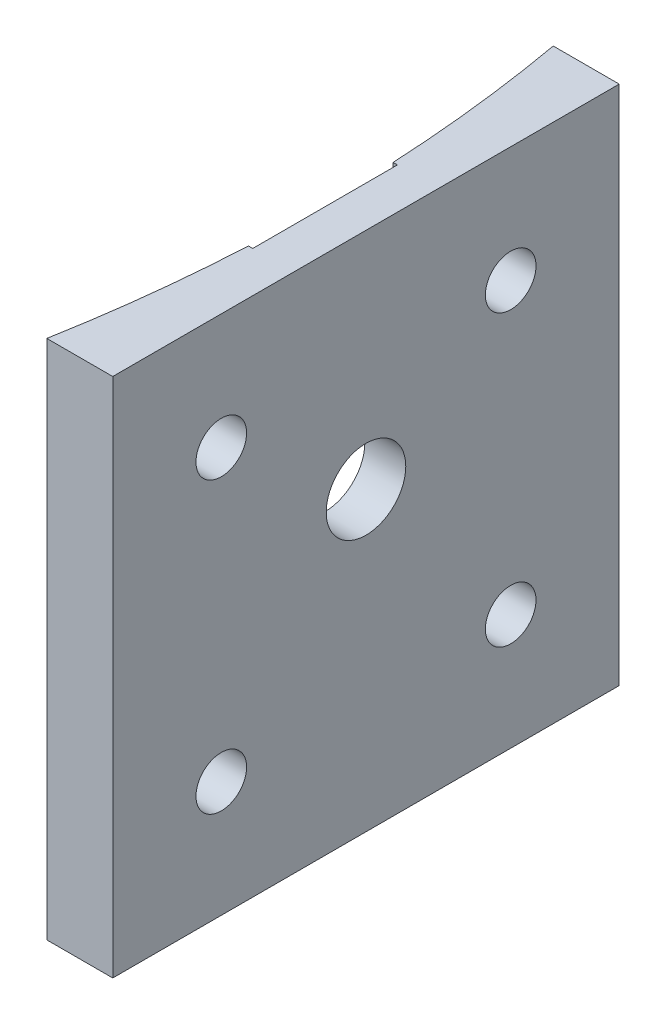
from build123d import *

# Parameters (mm, degrees)
EXTRUDE_1_DEPTH     = 36
SKETCH_2_R          = 1.75
CUT_EXTRUDE_1_DEPTH = 41.28690122
SKETCH_3_W          = 0.252686492
SKETCH_3_H          = 10
EXTRUDE_2_DEPTH     = 36
SKETCH_4_R          = 2.75
CUT_EXTRUDE_2_DEPTH = 41.286901364
SKETCH_5_W          = 10
SKETCH_5_H          = 36
CUT_EXTRUDE_3_DEPTH = 0.3


with BuildPart() as part:
    # Эскиз1 → Бобышка-Вытянуть1 (new body)
    with BuildSketch(Plane(origin=(0, 0, 0), x_dir=(1, 0, 0), z_dir=(0, 1, 0))):
        with BuildLine():
            Line((-4.558992206, 17.5), (0, 17.5))
            Line((0, 17.5), (0, -17.5))
            Line((0, -17.5), (-4.558992206, -17.5))
            ThreePointArc((-4.558992206, -17.5), (-3, 0), (-4.558992206, 17.5))
        make_face()
    extrude(amount=EXTRUDE_1_DEPTH)

    # Эскиз2 → Вырез-Вытянуть1 (cut, through all)
    with BuildSketch(Plane(origin=(0, 0, 0), x_dir=(0, 0, -1), z_dir=(1, 0, 0))):
        with Locations((-10, 28)):
            Circle(SKETCH_2_R)
        with Locations((10, 28)):
            Circle(SKETCH_2_R)
        with Locations((10, 8)):
            Circle(SKETCH_2_R)
        with Locations((-10, 8)):
            Circle(SKETCH_2_R)
    extrude(amount=-CUT_EXTRUDE_1_DEPTH, mode=Mode.SUBTRACT)

    # Эскиз3 → Бобышка-Вытянуть2 (add, through all)
    with BuildSketch(Plane(origin=(0, 36, 0), x_dir=(1, 0, 0), z_dir=(0, 1, 0))):
        with Locations((-3, 0)):
            Rectangle(SKETCH_3_W, SKETCH_3_H)
    extrude(amount=-EXTRUDE_2_DEPTH)

    # Эскиз4 → Вырез-Вытянуть2 (cut, through all)
    with BuildSketch(Plane(origin=(0, 0, 0), x_dir=(0, 0, -1), z_dir=(1, 0, 0))):
        with Locations((0, 20.5)):
            Circle(SKETCH_4_R)
    extrude(amount=-CUT_EXTRUDE_2_DEPTH, mode=Mode.SUBTRACT)

    # Эскиз5 → Вырез-Вытянуть3 (cut)
    with BuildSketch(Plane.ZY.offset(3.126343246)):
        with Locations((0, 18)):
            Rectangle(SKETCH_5_W, SKETCH_5_H)
    extrude(amount=-CUT_EXTRUDE_3_DEPTH, mode=Mode.SUBTRACT)


solid = part.part
